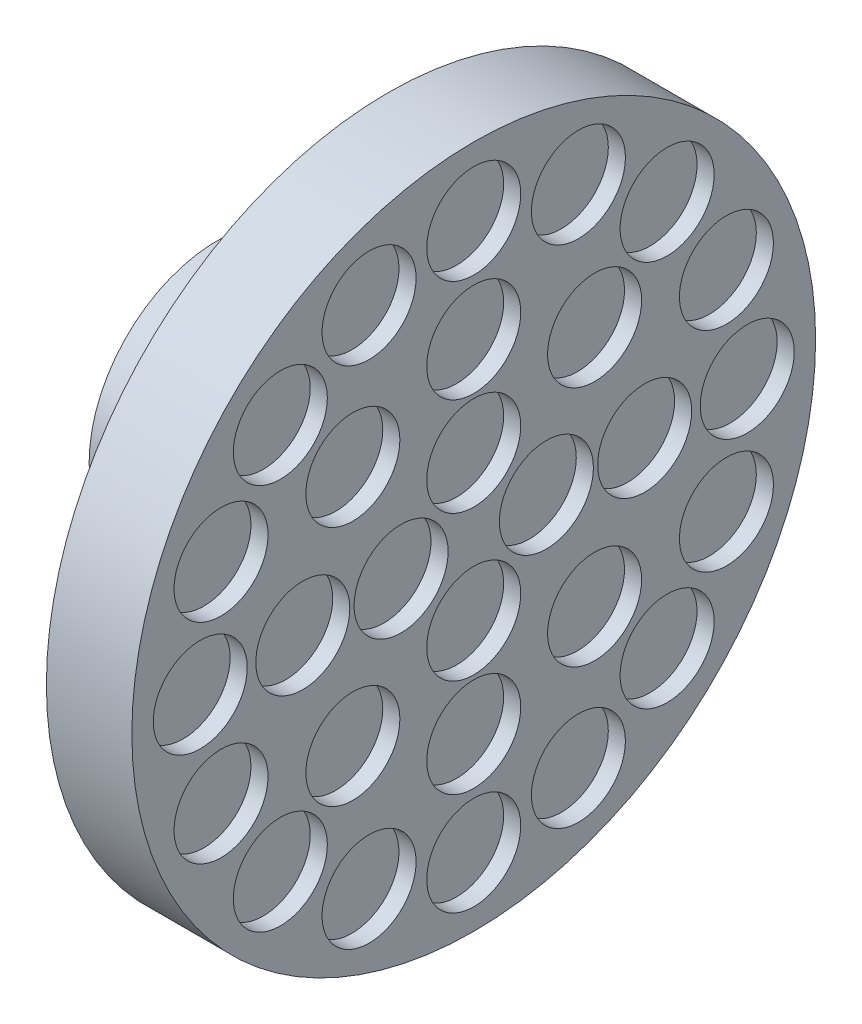
from build123d import *

# Parameters (mm, degrees)
ESQUISSE1_R             = 40
BOSS_EXTRU_2_DEPTH      = 10
ESQUISSE5_R             = 5.5
ENL_V_MAT_EXTRU_2_DEPTH = 2
ESQUISSE6_R             = 15
BOSS_EXTRU_3_DEPTH      = 20
CONG_1_R                = 10
ESQUISSE7_R             = 5
ENL_V_MAT_EXTRU_3_DEPTH = 16


with BuildPart() as part:
    # Esquisse1 → Boss.-Extru.2 (new body)
    with BuildSketch(Plane.YZ):
        with Locations(Location((0, 0, 0), (0, 0, 270))):
            Circle(ESQUISSE1_R)
    extrude(amount=BOSS_EXTRU_2_DEPTH)

    # Esquisse5 → Enlèv. mat.-Extru.2 (cut)
    with BuildSketch(Plane.YZ.offset(10)):
        with Locations(Location((0, 32, 0), (0, 0, 270))):
            Circle(ESQUISSE5_R)
        with Locations(Location((12.245869836, 29.56414504, 0), (0, 0, 270))):
            Circle(ESQUISSE5_R)
        with Locations(Location((22.627416998, 22.627416998, 0), (0, 0, 270))):
            Circle(ESQUISSE5_R)
        with Locations(Location((29.56414504, 12.245869836, 0), (0, 0, 270))):
            Circle(ESQUISSE5_R)
        with Locations(Location((32, 0, 0), (0, 0, 270))):
            Circle(ESQUISSE5_R)
        with Locations(Location((29.56414504, -12.245869836, 0), (0, 0, 270))):
            Circle(ESQUISSE5_R)
        with Locations(Location((22.627416998, -22.627416998, 0), (0, 0, 270))):
            Circle(ESQUISSE5_R)
        with Locations(Location((12.245869836, -29.56414504, 0), (0, 0, 270))):
            Circle(ESQUISSE5_R)
        with Locations(Location((0, -32, 0), (0, 0, 270))):
            Circle(ESQUISSE5_R)
        with Locations(Location((-12.245869836, -29.56414504, 0), (0, 0, 270))):
            Circle(ESQUISSE5_R)
        with Locations(Location((-22.627416998, -22.627416998, 0), (0, 0, 270))):
            Circle(ESQUISSE5_R)
        with Locations(Location((-29.56414504, -12.245869836, 0), (0, 0, 270))):
            Circle(ESQUISSE5_R)
        with Locations(Location((-32, 0, 0), (0, 0, 270))):
            Circle(ESQUISSE5_R)
        with Locations(Location((-29.56414504, 12.245869836, 0), (0, 0, 270))):
            Circle(ESQUISSE5_R)
        with Locations(Location((-22.627416998, 22.627416998, 0), (0, 0, 270))):
            Circle(ESQUISSE5_R)
        with Locations(Location((-12.245869836, 29.56414504, 0), (0, 0, 270))):
            Circle(ESQUISSE5_R)
        with Locations(Location((0, 20, 0), (0, 0, 270))):
            Circle(ESQUISSE5_R)
        with Locations(Location((14.142135624, 14.142135624, 0), (0, 0, 270))):
            Circle(ESQUISSE5_R)
        with Locations(Location((20, 0, 0), (0, 0, 270))):
            Circle(ESQUISSE5_R)
        with Locations(Location((14.142135624, -14.142135624, 0), (0, 0, 270))):
            Circle(ESQUISSE5_R)
        with Locations(Location((0, -20, 0), (0, 0, 270))):
            Circle(ESQUISSE5_R)
        with Locations(Location((-14.142135624, -14.142135624, 0), (0, 0, 270))):
            Circle(ESQUISSE5_R)
        with Locations(Location((-20, 0, 0), (0, 0, 270))):
            Circle(ESQUISSE5_R)
        with Locations(Location((-14.142135624, 14.142135624, 0), (0, 0, 270))):
            Circle(ESQUISSE5_R)
        with Locations(Location((0, 8.5, 0), (0, 0, 270))):
            Circle(ESQUISSE5_R)
        with Locations(Location((8.5, 0, 0), (0, 0, 270))):
            Circle(ESQUISSE5_R)
        with Locations(Location((0, -8.5, 0), (0, 0, 270))):
            Circle(ESQUISSE5_R)
        with Locations(Location((-8.5, 0, 0), (0, 0, 270))):
            Circle(ESQUISSE5_R)
    extrude(amount=-ENL_V_MAT_EXTRU_2_DEPTH, mode=Mode.SUBTRACT)

    # Esquisse6 → Boss.-Extru.3 (add)
    with BuildSketch(Plane(origin=(0, 0, 0), x_dir=(0, -1, 0), z_dir=(-1, 0, 0))):
        with Locations(Location((0, 0, 0), (0, 0, 90))):
            Circle(ESQUISSE6_R)
    extrude(amount=BOSS_EXTRU_3_DEPTH)

    # Congé1
    cong_1_edges = [part.edges().sort_by_distance(p)[0] for p in [
        (0, 0, -15),
    ]]
    fillet(cong_1_edges, radius=CONG_1_R)

    # Esquisse7 → Enlèv. mat.-Extru.3 (cut)
    with BuildSketch(Plane.ZY.offset(20)):
        Circle(ESQUISSE7_R)
    extrude(amount=-ENL_V_MAT_EXTRU_3_DEPTH, mode=Mode.SUBTRACT)


solid = part.part
